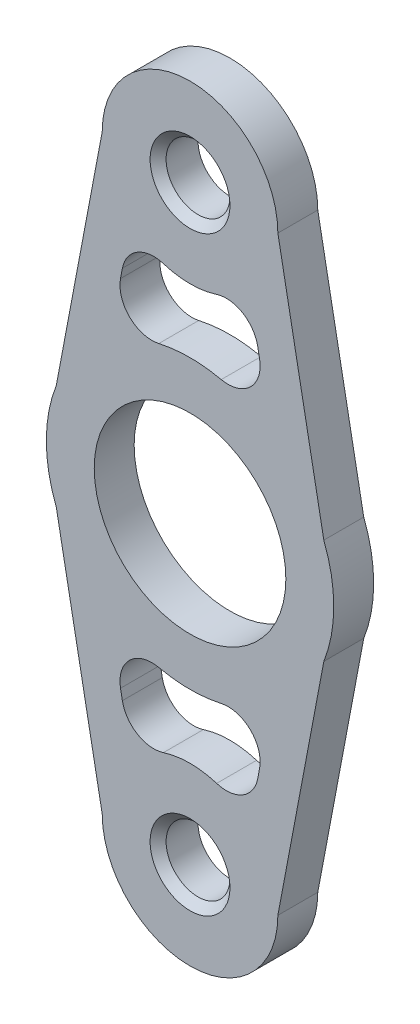
from build123d import *

# Parameters (mm, degrees)
SKETCH1_R           = 12
SKETCH1_R_2         = 4
BOSS_EXTRUDE1_DEPTH = 5
CHAMFER1_SIZE       = 1


with BuildPart() as part:
    # Sketch1 → Boss-Extrude1 (new body)
    with BuildSketch(Plane(origin=(0, 0, 0), x_dir=(0, 1, 0), z_dir=(0, 0, 1))):
        with BuildLine():
            Line((6.575458392, 16.755994358), (37, 11))
            ThreePointArc((37, 11), (48, 0), (37, -11))
            Line((37, -11), (6.575458392, -16.755994358))
            ThreePointArc((6.575458392, -16.755994358), (0, -18), (-6.575458392, -16.755994358))
            Line((-6.575458392, -16.755994358), (-37, -11))
            ThreePointArc((-37, -11), (-48, 0), (-37, 11))
            Line((-37, 11), (-6.575458392, 16.755994358))
            ThreePointArc((-6.575458392, 16.755994358), (0, 18), (6.575458392, 16.755994358))
        make_face()
        with Locations(Location((0, 0, 0), (0, 0, 270))):
            Circle(SKETCH1_R, mode=Mode.SUBTRACT)
        with Locations(Location((37, 0, 0), (0, 0, 270))):
            Circle(SKETCH1_R_2, mode=Mode.SUBTRACT)
        with Locations(Location((-37, 0, 0), (0, 0, 90))):
            Circle(SKETCH1_R_2, mode=Mode.SUBTRACT)
        with BuildLine():
            Line((23.448643014, 8.475075542), (22.218560764, 8.707793806))
            ThreePointArc((22.218560764, 8.707793806), (18.601781162, 7.560433495), (17.570449711, 3.908874128))
            ThreePointArc((17.570449711, 3.908874128), (18, 0), (17.570449711, -3.908874128))
            ThreePointArc((17.570449711, -3.908874128), (18.601781162, -7.560433495), (22.218560764, -8.707793806))
            Line((22.218560764, -8.707793806), (23.448643014, -8.475075542))
            ThreePointArc((23.448643014, -8.475075542), (26.140025122, -6.594459623), (26.517055984, -3.332849344))
            ThreePointArc((26.517055984, -3.332849344), (26, 0), (26.517055984, 3.332849344))
            ThreePointArc((26.517055984, 3.332849344), (26.140025122, 6.594459623), (23.448643014, 8.475075542))
        make_face(mode=Mode.SUBTRACT)
        with BuildLine():
            Line((-23.448643014, -8.475075542), (-22.218560764, -8.707793806))
            ThreePointArc((-22.218560764, -8.707793806), (-18.601781162, -7.560433495), (-17.570449711, -3.908874128))
            ThreePointArc((-17.570449711, -3.908874128), (-18, 0), (-17.570449711, 3.908874128))
            ThreePointArc((-17.570449711, 3.908874128), (-18.601781162, 7.560433495), (-22.218560764, 8.707793806))
            Line((-22.218560764, 8.707793806), (-23.448643014, 8.475075542))
            ThreePointArc((-23.448643014, 8.475075542), (-26.140025122, 6.594459623), (-26.517055984, 3.332849344))
            ThreePointArc((-26.517055984, 3.332849344), (-26, 0), (-26.517055984, -3.332849344))
            ThreePointArc((-26.517055984, -3.332849344), (-26.140025122, -6.594459623), (-23.448643014, -8.475075542))
        make_face(mode=Mode.SUBTRACT)
    extrude(amount=BOSS_EXTRUDE1_DEPTH)

    # Chamfer1
    chamfer1_edges = [part.edges().sort_by_distance(p)[0] for p in [
        (-4, 37, 5),
        (4, -37, 5),
    ]]
    chamfer(chamfer1_edges, length=CHAMFER1_SIZE)


solid = part.part
